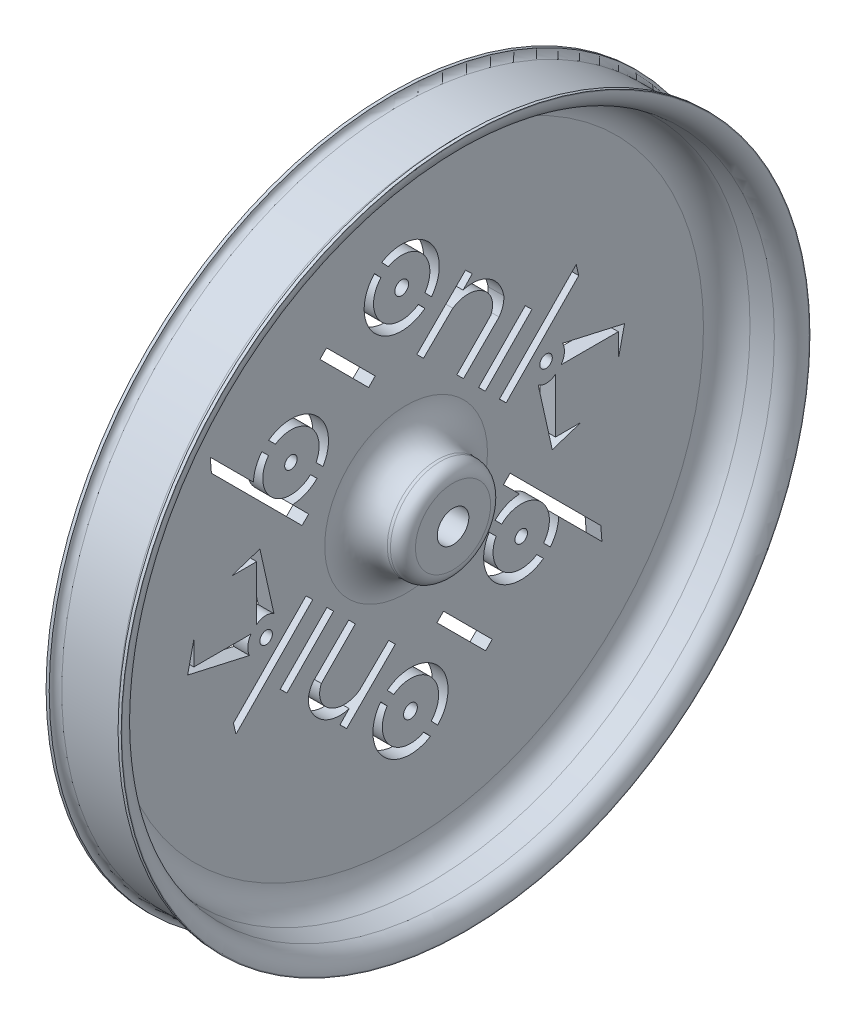
from build123d import *

# Parameters (mm, degrees)
SZKIC4_R                   = 2.525
WYTNIJ_WYCI_GNI_CIE8_DEPTH = 99.235601501
SZKIC5_R                   = 1
SZKIC5_R_2                 = 1.1
WYTNIJ_WYCI_GNI_CIE9_DEPTH = 99.185963366
ZAOKR_GLENIE1_R            = 2
ZAOKR_GLENIE4_R            = 5
SZYK_KO_OWY1_COUNT         = 2


with BuildPart() as part:
    # Szkic1 → Obrót1 (revolve)
    with BuildSketch(Plane.XY, mode=Mode.PRIVATE) as obr_t1_sk:
        with BuildLine():
            Line((7.5, -25.778916817), (-2.5, -25.778916817))
            Line((-2.5, -25.778916817), (-2.5, 29.221083183))
            Line((-2.5, 29.221083183), (-2, 29.221083183))
            Line((-2, 29.221083183), (-2, 29.218308719))
            ThreePointArc((-2, 29.218308719), (-1.707106781, 28.511201938), (-1, 28.218308719))
            Line((-1, 28.218308719), (8, 28.218308719))
            ThreePointArc((8, 28.218308719), (8.707106781, 28.511201938), (9, 29.218308719))
            Line((9, 29.218308719), (9, 29.221083183))
            Line((9, 29.221083183), (9.5, 29.221083183))
            Line((9.5, 29.221083183), (9.5, 29.114299039))
            ThreePointArc((9.5, 29.114299039), (8.757152352, 27.138125145), (6.89649116, 26.140615337))
            Line((6.89649116, 26.140615337), (3.47134512, 25.683929199))
            ThreePointArc((3.47134512, 25.683929199), (0.990463531, 24.353916121), (0, 21.719017596))
            Line((0, 21.719017596), (0, -17.778916817))
            Line((0, -17.778916817), (7.5, -17.778916817))
            Line((7.5, -17.778916817), (7.5, -25.778916817))
        make_face()
    revolve(obr_t1_sk.sketch.rotate(Axis((7.5, -25.778916817, 0), (-1, 0, 0)), 90), axis=Axis((7.5, -25.778916817, 0), (-1, 0, 0)))

    # Szkic4 → Wytnij-wyciągnięcie8 (cut, through all)
    with BuildSketch(Plane(origin=(7.5, 0, 0), x_dir=(0, 0, -1), z_dir=(1, 0, 0))):
        with Locations(Location((0, -25.778916817, 0), (0, 0, 90))):
            Circle(SZKIC4_R)
    extrude(amount=-WYTNIJ_WYCI_GNI_CIE8_DEPTH, mode=Mode.SUBTRACT)

    # Szkic5 → Wytnij-wyciągnięcie9 (cut, through all)
    with BuildSketch(Plane(origin=(0, 0, 0), x_dir=(0, 0, -1), z_dir=(1, 0, 0))):
        with Locations(Location((-18.388839437, -11.466671405, 0), (0, 0, 90))):
            Circle(SZKIC5_R)
        with Locations(Location((-0.700011726, 3.849054119, 0), (0, 0, 90))):
            Circle(SZKIC5_R_2)
        with Locations(Location((22.351446627, -17.848177907, 0), (0, 0, 90))):
            Circle(SZKIC5_R)
        with BuildLine():
            Line((-31.094841687, -6.613124119), (-16.615725978, -21.092239828))
            Line((-16.615725978, -21.092239828), (-15.555065806, -20.031579656))
            Line((-15.555065806, -20.031579656), (-18.125745054, -17.460900408))
            ThreePointArc((-18.125745054, -17.460900408), (-16.01586704, -16.97747915), (-14.214823562, -15.776844426))
            Line((-14.214823562, -15.776844426), (-15.27566585, -14.716002138))
            ThreePointArc((-15.27566585, -14.716002138), (-21.387422035, -14.822040596), (-21.966266492, -8.736833375))
            Line((-21.966266492, -8.736833375), (-23.034055299, -7.669044568))
            ThreePointArc((-23.034055299, -7.669044568), (-23.994432776, -9.327203406), (-24.38306844, -11.203577022))
            Line((-24.38306844, -11.203577022), (-31.277426391, -4.309219071))
            Line((-31.277426391, -4.309219071), (-31.094841687, -6.613124119))
        make_face()
        Polygon((-13.762623938, 0.462745665), (-12.701963767, 1.523405837), (-4.923789174, -6.254768757), (-5.984449345, -7.315428928), align=None)
        with BuildLine():
            Line((2.777823766, -7.658526292), (1.717163594, -6.597866121))
            Line((1.717163594, -6.597866121), (9.495338187, 1.180308472))
            Line((9.495338187, 1.180308472), (10.570018386, 0.133856146))
            Line((10.570018386, 0.133856146), (9.092674077, -1.383339271))
            ThreePointArc((9.092674077, -1.383339271), (13.266335097, -1.934512068), (15.610113794, -5.431645063))
            ThreePointArc((15.610113794, -5.431645063), (15.454216267, -6.774350594), (14.851569634, -7.984300683))
            Line((14.851569634, -7.984300683), (9.16797181, -13.667898507))
            Line((9.16797181, -13.667898507), (8.107311638, -12.607238335))
            Line((8.107311638, -12.607238335), (13.531289778, -7.083155107))
            ThreePointArc((13.531289778, -7.083155107), (13.755364684, -5.204613003), (12.856866184, -3.539731492))
            ThreePointArc((12.856866184, -3.539731492), (10.244628749, -2.348660318), (7.466378572, -3.072373603))
            Line((7.466378572, -3.072373603), (2.777823766, -7.658526292))
        make_face()
        Polygon((19.034204321, -8.50770115), (20.104518041, -9.558619101), (12.651151004, -17.149545682), (11.580837283, -16.098627732), align=None)
        Polygon((14.909999771, -19.367460552), (27.173004637, -6.878129336), (27.57133674, -8.613431014), (15.980313491, -20.418378503), align=None)
        with BuildLine():
            Line((25.017895383, -16.692349683), (34.890895944, -18.91825075))
            Line((34.890895944, -18.91825075), (33.893395016, -23.342673454))
            Line((33.893395016, -23.342673454), (33.893395016, -19.540337611))
            Line((33.893395016, -19.540337611), (24.76065193, -19.540337611))
            ThreePointArc((24.76065193, -19.540337611), (25.276488263, -18.151318663), (25.017895383, -16.692349683))
        make_face()
        with BuildLine():
            Line((21.102547463, -20.521464819), (23.349890256, -30.595343288))
            Line((23.349890256, -30.595343288), (27.925501355, -29.098609188))
            Line((27.925501355, -29.098609188), (23.865039811, -29.098609188))
            Line((23.865039811, -29.098609188), (23.865039811, -20.39214657))
            ThreePointArc((23.865039811, -20.39214657), (22.505330451, -20.916874434), (21.102547463, -20.521464819))
        make_face()
        with BuildLine():
            Line((-13.271360049, -14.598987595), (-14.373050639, -13.497297005))
            ThreePointArc((-14.373050639, -13.497297005), (-15.396196984, -8.106003146), (-20.869569347, -7.712210177))
            Line((-20.869569347, -7.712210177), (-21.946541948, -6.635237576))
            ThreePointArc((-21.946541948, -6.635237576), (-14.331308837, -7.046666266), (-13.271360049, -14.598987595))
        make_face()
        with BuildLine():
            Line((-2.824040128, 7.816232379), (-3.888175064, 8.931928751))
            ThreePointArc((-3.888175064, 8.931928751), (3.737293337, 7.887658306), (4.061143089, 0.197834483))
            Line((4.061143089, 0.197834483), (3.00903432, 1.300921974))
            ThreePointArc((3.00903432, 1.300921974), (2.65265701, 6.85065575), (-2.824040128, 7.816232379))
        make_face()
        with BuildLine():
            Line((-4.015299992, 6.89189222), (-5.052299234, 7.97913807))
            ThreePointArc((-5.052299234, 7.97913807), (-5.136070021, -0.190919494), (3.006195703, -0.869423018))
            Line((3.006195703, -0.869423018), (1.964521099, 0.222724732))
            ThreePointArc((1.964521099, 0.222724732), (-4.050432507, 0.844943504), (-4.015299992, 6.89189222))
        make_face()
    wytnij_wyci_gni_cie9 = extrude(amount=-WYTNIJ_WYCI_GNI_CIE9_DEPTH, mode=Mode.SUBTRACT)

    # Zaokrąglenie1
    zaokr_glenie1_edges = [part.edges().sort_by_distance(p)[0] for p in [
        (7.5, -25.778916817, 8),
    ]]
    fillet(zaokr_glenie1_edges, radius=ZAOKR_GLENIE1_R)

    # Zaokrąglenie4
    zaokr_glenie4_edges = [part.edges().sort_by_distance(p)[0] for p in [
        (0, -25.778916817, 8),
    ]]
    fillet(zaokr_glenie4_edges, radius=ZAOKR_GLENIE4_R)

    # Szyk kołowy1: Wytnij-wyciągnięcie9 ×2 about axis
    szyk_ko_owy1_axis = Axis((0, -25.778916817, 0), (1, 0, 0))
    for i in range(1, SZYK_KO_OWY1_COUNT):
        add(wytnij_wyci_gni_cie9.rotate(szyk_ko_owy1_axis, i * 360 / SZYK_KO_OWY1_COUNT), mode=Mode.SUBTRACT)


solid = part.part
